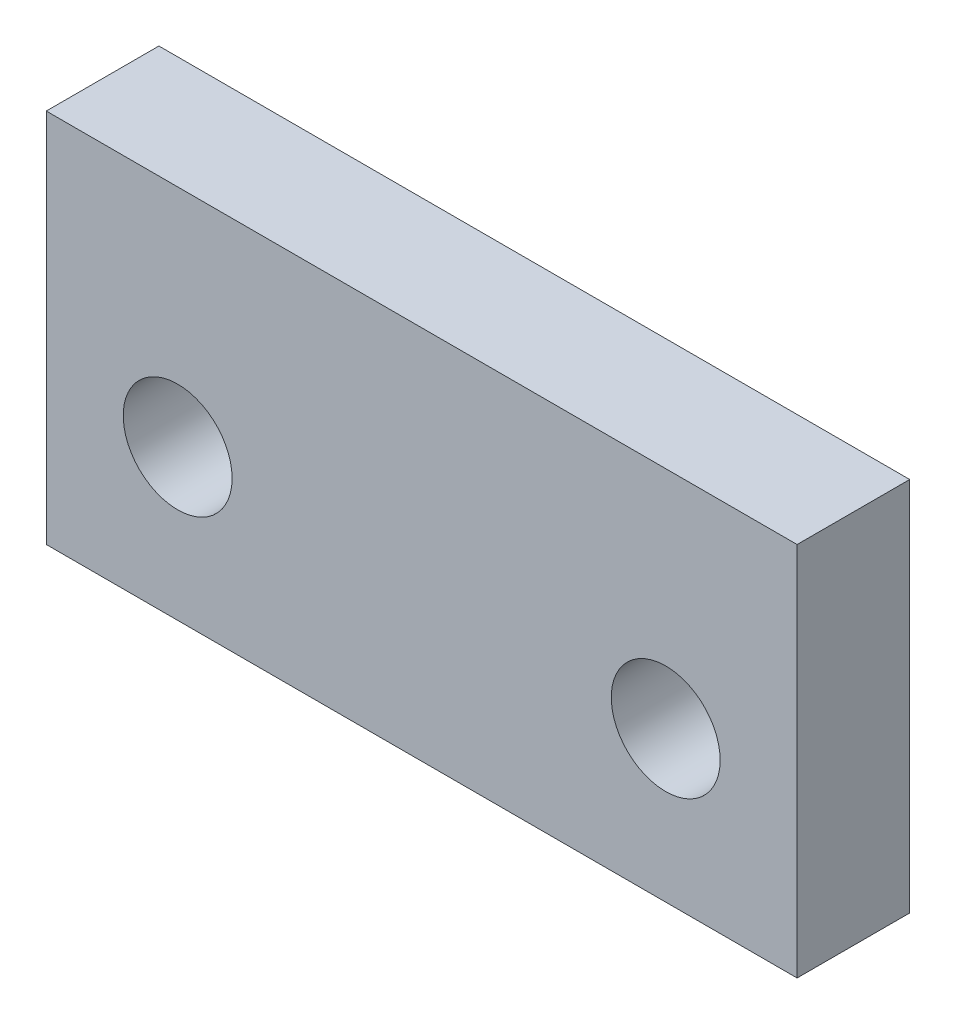
from build123d import *

# Parameters (mm, degrees)
SKETCH_1_W      = 20
SKETCH_1_H      = 10
SKETCH_1_R      = 1.45
EXTRUDE_1_DEPTH = 3


with BuildPart() as part:
    # 草图1 → 凸台-拉伸1 (new body)
    with BuildSketch(Plane.XY):
        with Locations((10, -5)):
            Rectangle(SKETCH_1_W, SKETCH_1_H)
        with Locations((3.5, -6)):
            Circle(SKETCH_1_R, mode=Mode.SUBTRACT)
        with Locations((16.5, -6)):
            Circle(SKETCH_1_R, mode=Mode.SUBTRACT)
    extrude(amount=EXTRUDE_1_DEPTH)


solid = part.part
